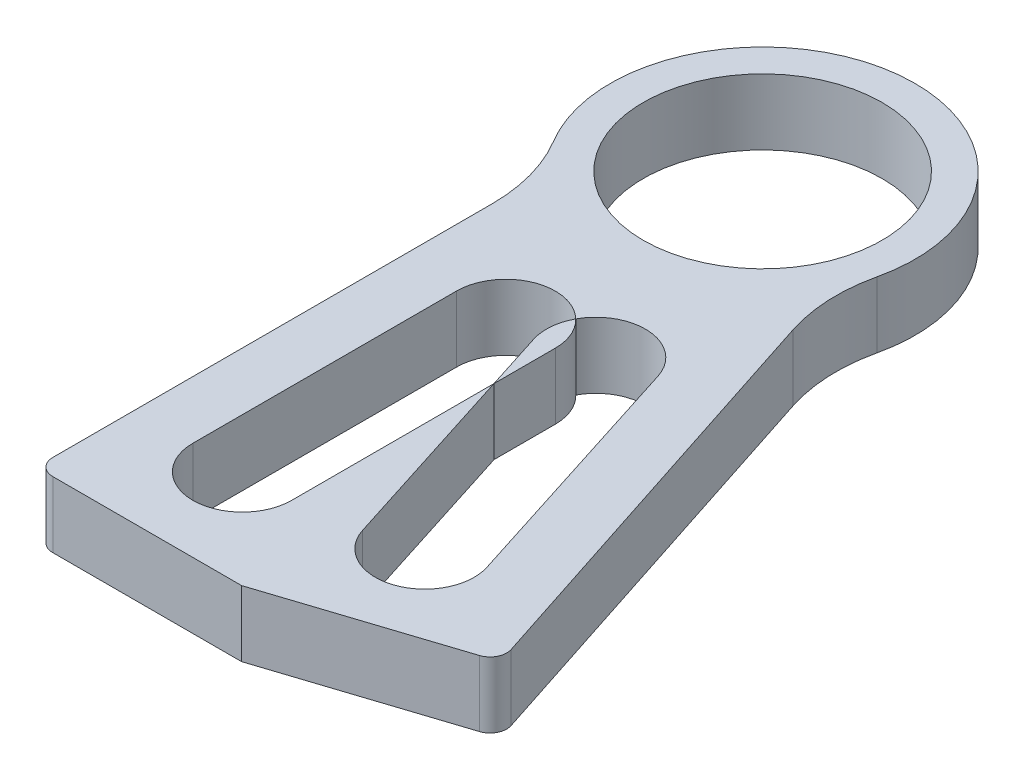
from build123d import *

# Parameters (mm, degrees)
SKETCH1_R           = 11.5062
BOSS_EXTRUDE1_DEPTH = 6.35
FILLET1_R           = 1.6002
FILLET2_R           = 15.875
CUT_EXTRUDE1_DEPTH  = 6.35


with BuildPart() as part:
    # Sketch1 → Boss-Extrude1 (new body)
    with BuildSketch(Plane(origin=(0, 0, 0), x_dir=(1, 0, 0), z_dir=(0, 1, 0))):
        with BuildLine():
            Line((-10.3251, -10.436950868), (-10.3251, -59.659625888))
            Line((-10.3251, -59.659625888), (9.459830419, -59.659625888))
            Line((9.459830419, -59.659625888), (28.274282324, -53.539178236))
            Line((28.274282324, -53.539178236), (13.047299162, -6.730944809))
            ThreePointArc((13.047299162, -6.730944809), (-2.299176439, 14.500049005), (-10.3251, -10.436950868))
        make_face()
        with Locations(Location((0, 0, 0), (0, 0, 270))):
            Circle(SKETCH1_R, mode=Mode.SUBTRACT)
    extrude(amount=BOSS_EXTRUDE1_DEPTH)

    # Fillet1
    fillet1_edges = [part.edges().sort_by_distance(p)[0] for p in [
        (28.274282324, 3.175, 53.539178236),
        (-10.3251, 3.175, 59.659625888),
    ]]
    fillet(fillet1_edges, radius=FILLET1_R)

    # Fillet2
    fillet2_edges = [part.edges().sort_by_distance(p)[0] for p in [
        (13.047299162, 3.175, 6.730944809),
        (-10.3251, 3.175, 10.436950868),
    ]]
    fillet(fillet2_edges, radius=FILLET2_R)

    # Sketch2 → Cut-Extrude1 (cut)
    with BuildSketch(Plane(origin=(0, 6.35, 0), x_dir=(1, 0, 0), z_dir=(0, 1, 0))):
        with BuildLine():
            Line((-4.7625, -24.734625888), (-4.7625, -50.134625888))
            ThreePointArc((-4.7625, -50.134625888), (0, -54.897125888), (4.7625, -50.134625888))
            Line((4.7625, -50.134625888), (4.7625, -30.645176967))
            Line((4.7625, -30.645176967), (2.968585925, -25.012937053))
            ThreePointArc((2.968585925, -25.012937053), (2.764324982, -23.127703518), (3.311866053, -21.312207226))
            ThreePointArc((3.311866053, -21.312207226), (-1.858580664, -20.349755974), (-4.7625, -24.734625888))
        make_face()
        with BuildLine():
            ThreePointArc((12.044347964, -22.122233262), (7.946348584, -18.825443195), (3.311866053, -21.312207226))
            ThreePointArc((3.311866053, -21.312207226), (4.384869914, -22.876045223), (4.7625, -24.734625888))
            Line((4.7625, -24.734625888), (4.7625, -30.645176967))
            Line((4.7625, -30.645176967), (10.677129365, -49.214969158))
            ThreePointArc((10.677129365, -49.214969158), (16.66036228, -52.307498282), (19.752891405, -46.324265367))
            Line((19.752891405, -46.324265367), (12.044347964, -22.122233262))
        make_face()
    extrude(amount=-CUT_EXTRUDE1_DEPTH, mode=Mode.SUBTRACT)


with BuildPart() as cut_extrude1_piece_1:
    # of the separate pieces the step leaves, piece 1, a body of its own (cut_extrude1_pieces)
    add(part.part.solids().sort_by_distance((-10.3251, 0, 15.723743779))[0])


with BuildPart() as cut_extrude1_piece_2:
    # of the separate pieces the step leaves, piece 2, a body of its own (cut_extrude1_pieces)
    add(part.part.solids().sort_by_distance((4.7625, 0, 24.734625888))[0])


solid = Compound([cut_extrude1_piece_1.part, cut_extrude1_piece_2.part])
